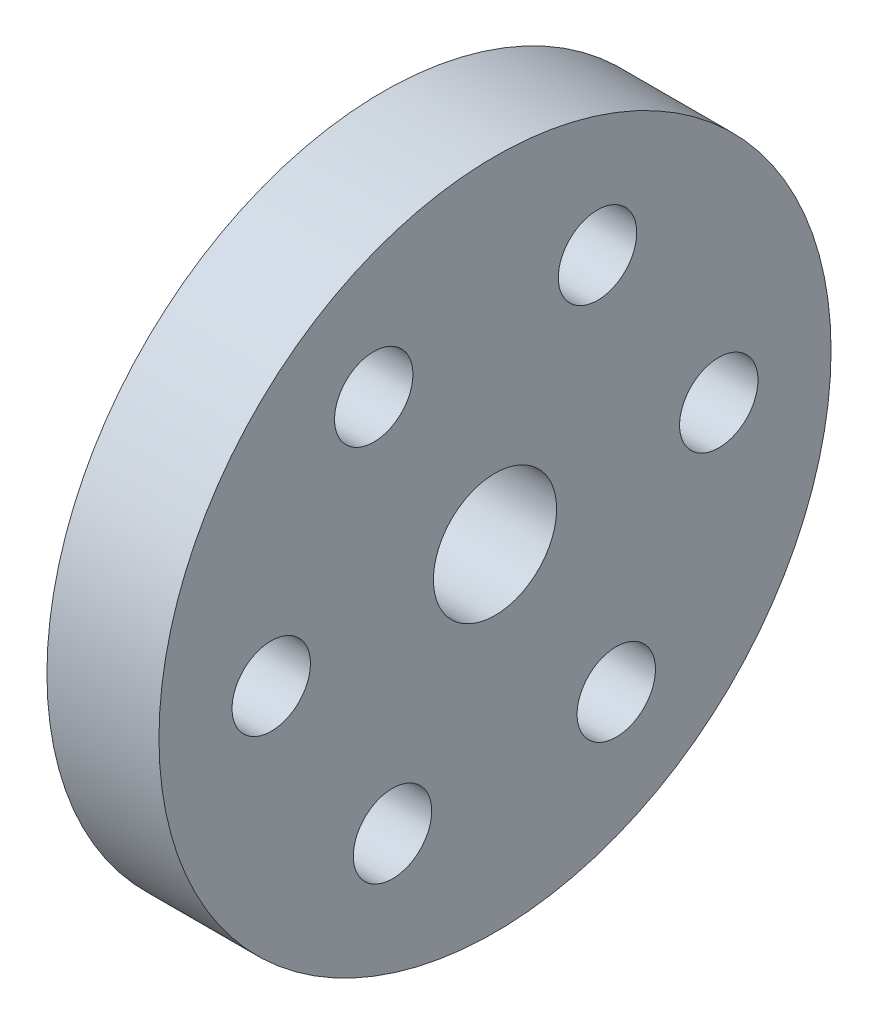
from build123d import *

# Parameters (mm, degrees)
SKETCH1_R           = 15
SKETCH1_R_2         = 2.75
BOSS_EXTRUDE1_DEPTH = 5
SKETCH3_R           = 1.75
CUT_EXTRUDE1_DEPTH  = 22.794494718


with BuildPart() as part:
    # Sketch1 → Boss-Extrude1 (new body)
    with BuildSketch(Plane(origin=(0, 0, 0), x_dir=(0, 0, -1), z_dir=(1, 0, 0))):
        Circle(SKETCH1_R)
        Circle(SKETCH1_R_2, mode=Mode.SUBTRACT)
    extrude(amount=BOSS_EXTRUDE1_DEPTH)

    # Sketch3 → Cut-Extrude1 (cut, through all)
    with BuildSketch(Plane(origin=(5, 0, 0), x_dir=(0, 0, -1), z_dir=(1, 0, 0))):
        with Locations((9.988309919, 0.483389029)):
            Circle(SKETCH3_R)
        with Locations((5.412782139, -8.408435617)):
            Circle(SKETCH3_R)
        with Locations((-4.575527781, -8.891824646)):
            Circle(SKETCH3_R)
        with Locations((-9.988309919, -0.483389029)):
            Circle(SKETCH3_R)
        with Locations((-5.412782139, 8.408435617)):
            Circle(SKETCH3_R)
        with Locations((4.575527781, 8.891824646)):
            Circle(SKETCH3_R)
    extrude(amount=-CUT_EXTRUDE1_DEPTH, mode=Mode.SUBTRACT)


solid = part.part
